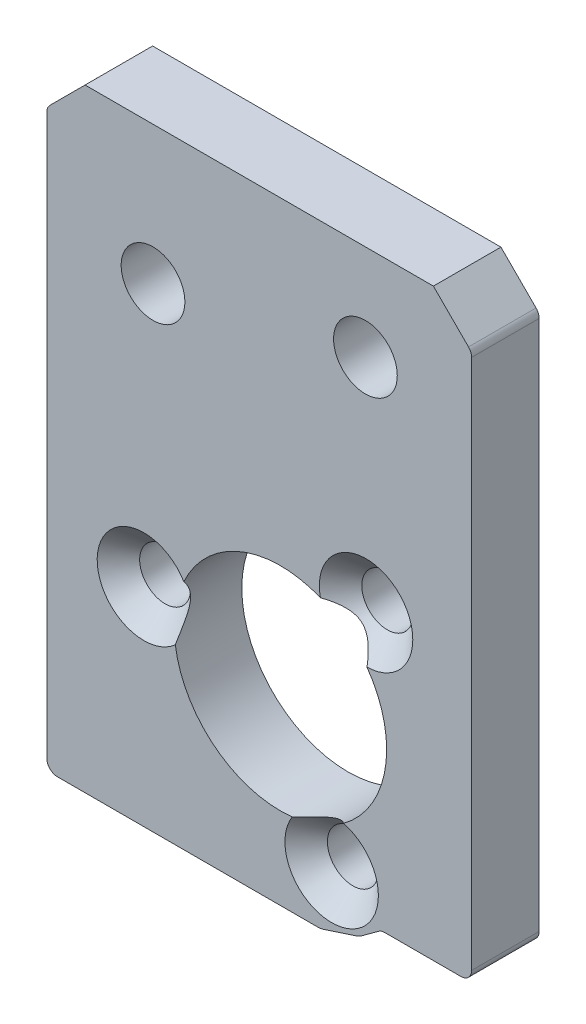
from build123d import *

# Parameters (mm, degrees)
SKETCH1_W                                       = 20
SKETCH1_H                                       = 29.11
SKETCH1_R                                       = 1.5
SKETCH1_R_2                                     = 1.2
SKETCH1_R_3                                     = 5
BOSS_EXTRUDE2_DEPTH                             = 3.18
CSK_FOR_M2_FLAT_HEAD_MACHINE_SCREW1_D           = 2.4
CSK_FOR_M2_FLAT_HEAD_MACHINE_SCREW1_DEPTH       = 3.508967257
CSK_FOR_M2_FLAT_HEAD_MACHINE_SCREW1_CSINK_D     = 4.4
CSK_FOR_M2_FLAT_HEAD_MACHINE_SCREW1_CSINK_ANGLE = 90
CSK_FOR_M2_FLAT_HEAD_MACHINE_SCREW1_TIP         = 0.721032743
CHAMFER1_SIZE                                   = 1.8
FILLET1_R                                       = 0.5
CUT_EXTRUDE1_DEPTH                              = 4
FILLET6_R                                       = 0.5
CUT_EXTRUDE2_DEPTH                              = 4
FILLET8_R                                       = 1


with BuildPart() as part:
    # Sketch1 → Boss-Extrude2 (new body)
    with BuildSketch(Plane.XY):
        with Locations((10, 14.555)):
            Rectangle(SKETCH1_W, SKETCH1_H)
        with Locations((5, 22.61)):
            Circle(SKETCH1_R, mode=Mode.SUBTRACT)
        with Locations((15, 24.61)):
            Circle(SKETCH1_R, mode=Mode.SUBTRACT)
        with Locations((15.03, 14.21)):
            Circle(SKETCH1_R_2, mode=Mode.SUBTRACT)
        with Locations((4.57, 10.04)):
            Circle(SKETCH1_R_2, mode=Mode.SUBTRACT)
        with Locations((13.41, 2.96)):
            Circle(SKETCH1_R_2, mode=Mode.SUBTRACT)
        with Locations((11, 9.11)):
            Circle(SKETCH1_R_3, mode=Mode.SUBTRACT)
    extrude(amount=-BOSS_EXTRUDE2_DEPTH)

    # CSK for M2 Flat Head Machine Screw1
    with Locations(Plane.XY):
        with Locations((4.57, 10.04), (15.03, 14.21), (13.41, 2.96)):
            CounterSinkHole(CSK_FOR_M2_FLAT_HEAD_MACHINE_SCREW1_D / 2, CSK_FOR_M2_FLAT_HEAD_MACHINE_SCREW1_CSINK_D / 2, depth=CSK_FOR_M2_FLAT_HEAD_MACHINE_SCREW1_DEPTH, counter_sink_angle=CSK_FOR_M2_FLAT_HEAD_MACHINE_SCREW1_CSINK_ANGLE)
            with Locations((0, 0, -(CSK_FOR_M2_FLAT_HEAD_MACHINE_SCREW1_DEPTH + CSK_FOR_M2_FLAT_HEAD_MACHINE_SCREW1_TIP / 2))):  # 118° drill point
                Cone(0, CSK_FOR_M2_FLAT_HEAD_MACHINE_SCREW1_D / 2, CSK_FOR_M2_FLAT_HEAD_MACHINE_SCREW1_TIP, mode=Mode.SUBTRACT)

    # Chamfer1
    chamfer1_edges = [part.edges().sort_by_distance(p)[0] for p in [
        (0, 29.11, -1.59),
        (20, 29.11, -1.59),
    ]]
    chamfer(chamfer1_edges, length=CHAMFER1_SIZE)

    # Fillet1
    fillet1_edges = [part.edges().sort_by_distance(p)[0] for p in [
        (0, 27.31, -1.59),
        (20, 27.31, -1.59),
    ]]
    fillet(fillet1_edges, radius=FILLET1_R)

    # Sketch12 → Cut-Extrude1 (cut)
    with BuildSketch(Plane(origin=(0, 0, -3.18), x_dir=(-1, 0, 0), z_dir=(0, 0, -1))):
        Polygon((0, 0), (-20, 0), (-20, 1.60680291), (-15.748577863, 1.60680291), (-13.898929975, 0.251358625), (0, 0.251358625), align=None)
    extrude(amount=-CUT_EXTRUDE1_DEPTH, mode=Mode.SUBTRACT)

    # Fillet6
    fillet6_edges = [part.edges().sort_by_distance(p)[0] for p in [
        (0, 0.251358625, -1.59),
        (20, 1.60680291, -1.59),
        (15.748577863, 1.60680291, -1.59),
    ]]
    fillet(fillet6_edges, radius=FILLET6_R)

    # Sketch14 → Cut-Extrude2 (cut)
    with BuildSketch(Plane.XY):
        Polygon((12.898929975, 0.251358625), (13.898929975, 0.251358625), (14.705535433, 0.842448835), align=None)
    extrude(amount=-CUT_EXTRUDE2_DEPTH, mode=Mode.SUBTRACT)

    # Fillet8
    fillet8_edges = [part.edges().sort_by_distance(p)[0] for p in [
        (12.898929975, 0.251358625, -1.59),
        (14.705535433, 0.842448835, -1.59),
    ]]
    fillet(fillet8_edges, radius=FILLET8_R)


solid = part.part
